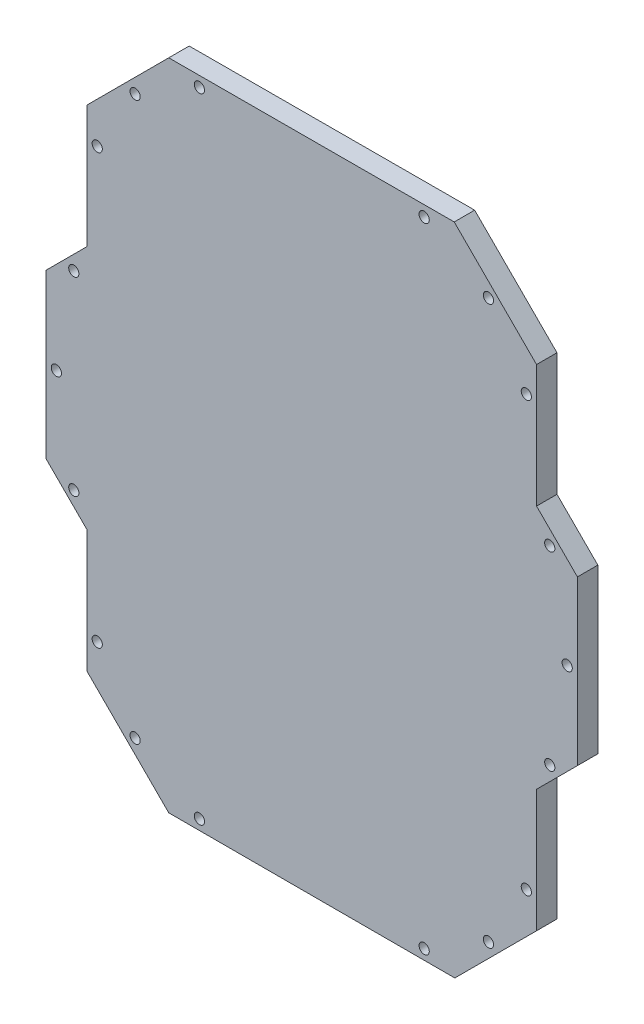
from build123d import *

# Parameters (mm, degrees)
MODEL_R             = 1.25
BOSS_EXTRUDE1_DEPTH = 5


with BuildPart() as part:
    # Model → Boss-Extrude1 (new body)
    with BuildSketch(Plane.XY):
        Polygon((105.055071144, 3.719759624), (125.055071144, 23.719759624), (125.055071144, 53.719759624), (135.055071144, 63.719759624), (135.055071144, 103.719759624), (125.055071144, 113.719759624), (125.055071144, 143.719759624), (104.909839245, 163.864991523), (35.058830231, 163.723518711), (15.055071144, 143.719759624), (15.055071144, 113.719759624), (5.055071144, 103.719759624), (5.055071144, 63.719759624), (15.055071144, 53.719759624), (15.055071144, 23.719759624), (35.055071144, 3.719759624), align=None)
        with Locations((97.555071144, 6.219759624)):
            Circle(MODEL_R, mode=Mode.SUBTRACT)
        with Locations((122.555071144, 31.219759624)):
            Circle(MODEL_R, mode=Mode.SUBTRACT)
        with Locations((113.287304191, 15.487526577)):
            Circle(MODEL_R, mode=Mode.SUBTRACT)
        with Locations((42.555071144, 6.219759624)):
            Circle(MODEL_R, mode=Mode.SUBTRACT)
        with Locations((17.555071144, 31.219759624)):
            Circle(MODEL_R, mode=Mode.SUBTRACT)
        with Locations((26.822838097, 15.487526577)):
            Circle(MODEL_R, mode=Mode.SUBTRACT)
        with Locations((97.555071144, 161.219759624)):
            Circle(MODEL_R, mode=Mode.SUBTRACT)
        with Locations((122.555071144, 136.219759624)):
            Circle(MODEL_R, mode=Mode.SUBTRACT)
        with Locations((113.287304191, 151.951992671)):
            Circle(MODEL_R, mode=Mode.SUBTRACT)
        with Locations((42.555071144, 161.219759624)):
            Circle(MODEL_R, mode=Mode.SUBTRACT)
        with Locations((17.555071144, 136.219759624)):
            Circle(MODEL_R, mode=Mode.SUBTRACT)
        with Locations((26.822838097, 151.951992671)):
            Circle(MODEL_R, mode=Mode.SUBTRACT)
        with Locations((11.822838097, 60.487526577)):
            Circle(MODEL_R, mode=Mode.SUBTRACT)
        with Locations((7.555071144, 83.719759624)):
            Circle(MODEL_R, mode=Mode.SUBTRACT)
        with Locations((11.822838097, 106.951992671)):
            Circle(MODEL_R, mode=Mode.SUBTRACT)
        with Locations((128.287304191, 60.487526577)):
            Circle(MODEL_R, mode=Mode.SUBTRACT)
        with Locations((132.555071144, 83.719759624)):
            Circle(MODEL_R, mode=Mode.SUBTRACT)
        with Locations((128.287304191, 106.951992671)):
            Circle(MODEL_R, mode=Mode.SUBTRACT)
    extrude(amount=BOSS_EXTRUDE1_DEPTH)


solid = part.part
